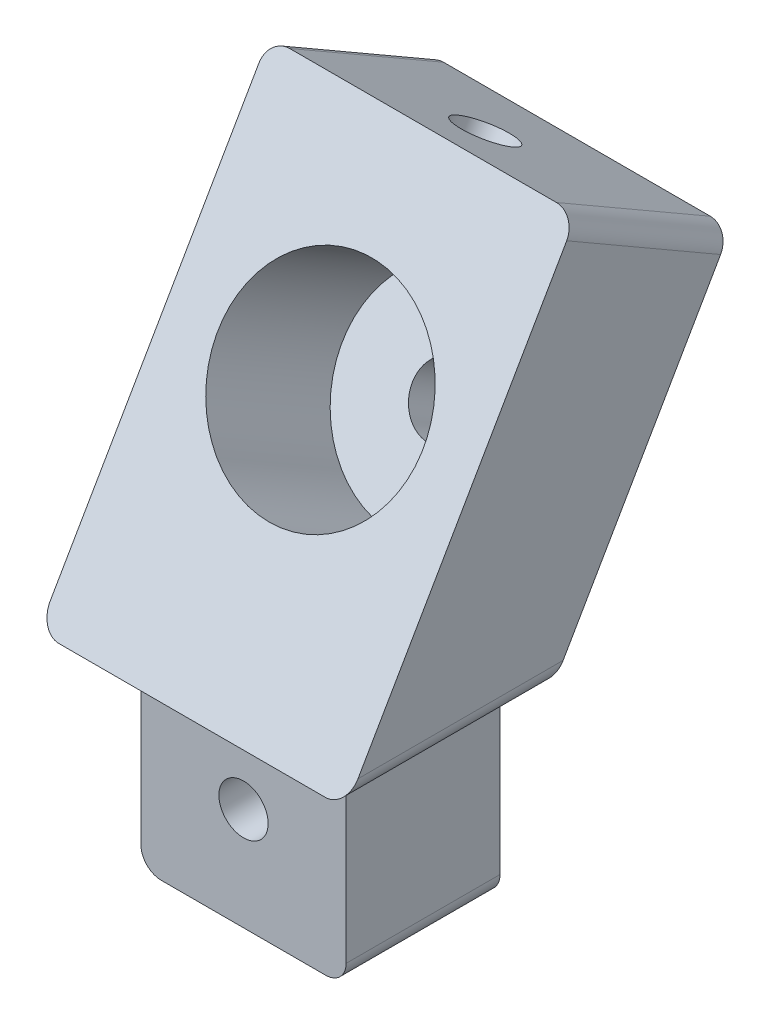
from build123d import *

# Parameters (mm, degrees)
SKETCH1_W            = 10
SKETCH1_H            = 10
BOSS_EXTRUDE1_DEPTH  = 3.75
SKETCH2_W            = 6.5
SKETCH2_H            = 6.5
CUT_EXTRUDE1_DEPTH   = 5
BOSS_EXTRUDE2_DEPTH  = 7.5
M2_CLEARANCE_HOLE1_D = 2.4
FILLET5_R            = 1
FILLET1_R            = 1
FILLET3_R            = 1
SKETCH17_R           = 5
CUT_EXTRUDE2_DEPTH   = 7
SKETCH5_R            = 1.5875
CUT_EXTRUDE3_DEPTH   = 5
FILLET4_R            = 1
CUT_EXTRUDE4_REACH   = 34.182
SKETCH18_R           = 1.35


with BuildPart() as part:
    # Sketch1 → Boss-Extrude1 (new, symmetric)
    with BuildSketch(Plane.XY):
        Rectangle(SKETCH1_W, SKETCH1_H)
    extrude(amount=BOSS_EXTRUDE1_DEPTH, both=True)

    # Sketch2 → Cut-Extrude1 (cut)
    with BuildSketch(Plane(origin=(0, 0, -3.75), x_dir=(-1, 0, 0), z_dir=(0, 0, -1))):
        Rectangle(SKETCH2_W, SKETCH2_H)
    extrude(amount=-CUT_EXTRUDE1_DEPTH, mode=Mode.SUBTRACT)

    # Sketch3 → Boss-Extrude2 (add, symmetric)
    with BuildSketch(Plane(origin=(0, 0, 0), x_dir=(0, 0, -1), z_dir=(1, 0, 0))):
        Polygon((-6.25, 5), (5, 24.485571585), (12.5, 20.155444566), (3.75, 5), align=None)
    extrude(amount=BOSS_EXTRUDE2_DEPTH, both=True)

    # M2 Clearance Hole1 (through all)
    with Locations(Plane.XY.offset(3.75)):
        with Locations((0, 0)):
            Hole(M2_CLEARANCE_HOLE1_D / 2)

    # Fillet5
    fillet5_edges = [part.edges().sort_by_distance(p)[0] for p in [
        (7.5, 5, 1.25),
        (7.5, 22.320508076, -8.75),
        (-7.5, 5, 1.25),
        (-7.5, 22.320508076, -8.75),
    ]]
    fillet(fillet5_edges, radius=FILLET5_R)

    # Fillet1
    fillet1_edges = [part.edges().sort_by_distance(p)[0] for p in [
        (5, 5, 0),
        (-5, 5, 0),
    ]]
    fillet(fillet1_edges, radius=FILLET1_R)

    # Fillet3
    fillet3_edges = [part.edges().sort_by_distance(p)[0] for p in [
        (5, -5, 0),
        (-5, -5, 0),
    ]]
    fillet(fillet3_edges, radius=FILLET3_R)

    # Sketch17 → Cut-Extrude2 (cut)
    with BuildSketch(Plane(origin=(0, 3.956329387, 6.852563509), x_dir=(1, 0, 0), z_dir=(0, 0.5000000000000039, 0.8660254037844365))):
        with Locations((0, 13.705127019)):
            Circle(SKETCH17_R)
    extrude(amount=-CUT_EXTRUDE2_DEPTH, mode=Mode.SUBTRACT)

    # Sketch5 → Cut-Extrude3 (cut)
    with BuildSketch(Plane(origin=(0, -0.373797632, -0.647436491), x_dir=(-1, 0, 0), z_dir=(0, -0.5000000000000038, -0.8660254037844366))):
        with Locations((0, 13.705127019)):
            Circle(SKETCH5_R)
    extrude(amount=-CUT_EXTRUDE3_DEPTH, mode=Mode.SUBTRACT)

    # Fillet4
    fillet4_edges = [part.edges().sort_by_distance(p)[0] for p in [
        (0, 5, 3.75),
    ]]
    fillet(fillet4_edges, radius=FILLET4_R)

    # Sketch18 → Cut-Extrude4 (cut, up to next)
    with BuildSketch(Plane(origin=(0, 20.529242198, -11.852563509), x_dir=(1, 0, 0), z_dir=(0, 0.8660254037844366, -0.5000000000000038)), mode=Mode.PRIVATE) as cut_extrude4_sk1:
        with Locations((0, -4.412658774)):
            Circle(SKETCH18_R)
    cut_extrude4_tool1 = extrude(cut_extrude4_sk1.sketch, amount=-CUT_EXTRUDE4_REACH, mode=Mode.PRIVATE) & part.part
    add(cut_extrude4_tool1.solids().sort_by_distance((0, 22.735572, -8.031089))[0], mode=Mode.SUBTRACT)


solid = part.part
